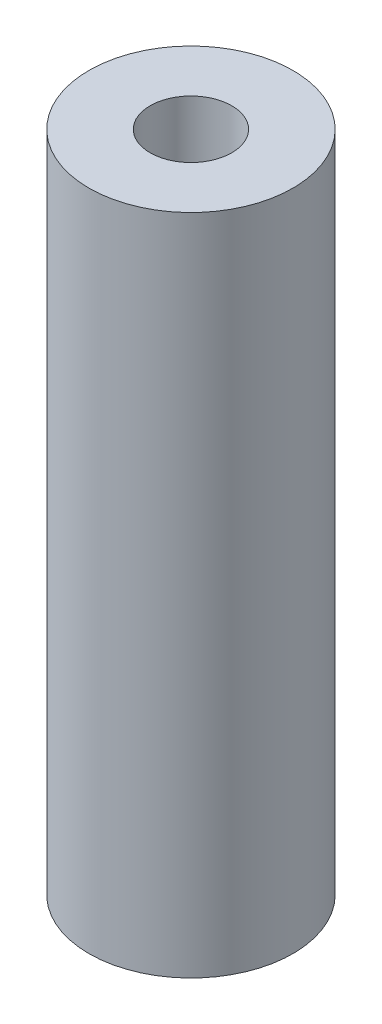
from build123d import *

# Parameters (mm, degrees)
CROQUIS2_R              = 10
CROQUIS2_R_2            = 4
SALIENTE_EXTRUIR1_DEPTH = 65


with BuildPart() as part:
    # Croquis2 → Saliente-Extruir1 (new body)
    with BuildSketch(Plane(origin=(0, 0, 0), x_dir=(1, 0, 0), z_dir=(0, 1, 0))):
        with Locations(Location((0, 0, 0), (0, 0, 270))):
            Circle(CROQUIS2_R)
        with Locations(Location((0, 0, 0), (0, 0, 270))):
            Circle(CROQUIS2_R_2, mode=Mode.SUBTRACT)
    extrude(amount=SALIENTE_EXTRUIR1_DEPTH)


solid = part.part
